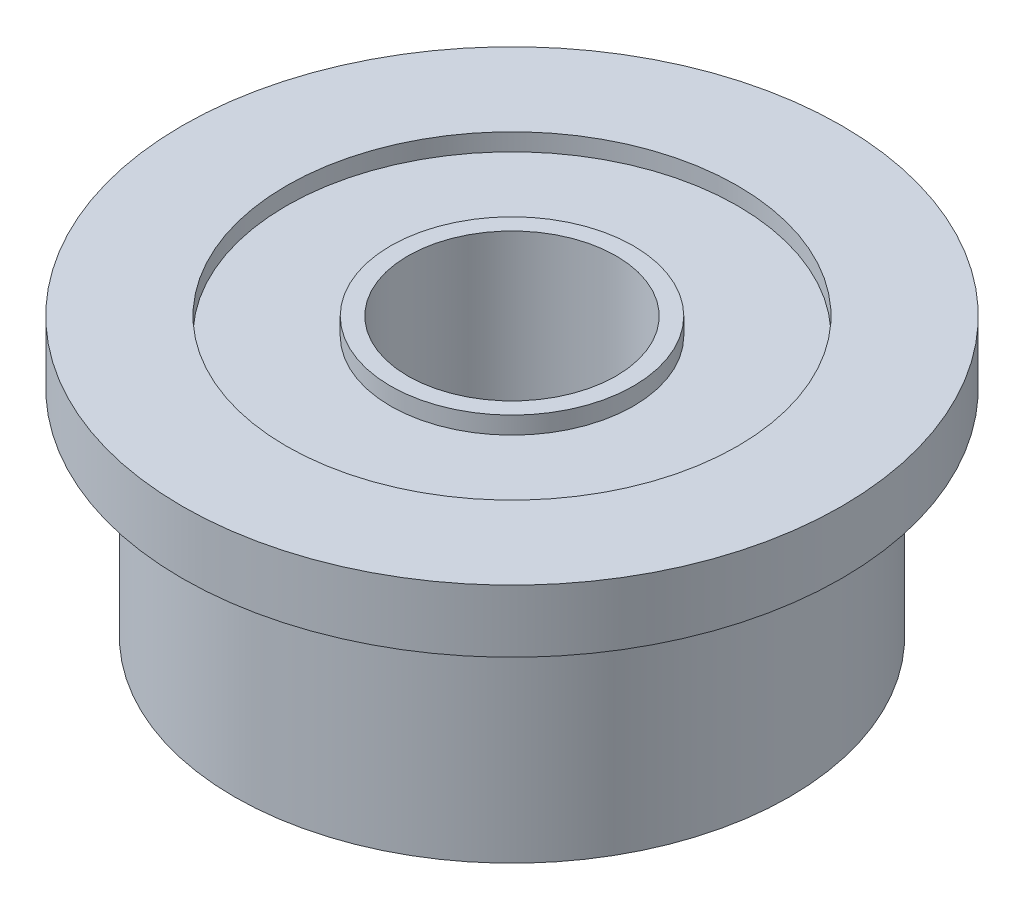
from build123d import *

# Parameters (mm, degrees)
SKETCH1_R           = 4
SKETCH1_R_2         = 1.5
BOSS_EXTRUDE1_DEPTH = 4
SKETCH2_R           = 3.25
SKETCH2_R_2         = 1.75
CUT_EXTRUDE1_DEPTH  = 0.25
BOSS_EXTRUDE2_START = -0.9
SKETCH3_R           = 4.75
SKETCH3_R_2         = 4
BOSS_EXTRUDE2_DEPTH = 0.9


with BuildPart() as part:
    # Sketch1 → Boss-Extrude1 (new body)
    with BuildSketch(Plane(origin=(0, 0, 0), x_dir=(1, 0, 0), z_dir=(0, 1, 0))):
        with Locations(Location((0, 0, 0), (0, 0, 270))):
            Circle(SKETCH1_R)
        with Locations(Location((0, 0, 0), (0, 0, 270))):
            Circle(SKETCH1_R_2, mode=Mode.SUBTRACT)
    extrude(amount=BOSS_EXTRUDE1_DEPTH)

    # Sketch2 → Cut-Extrude1 (cut)
    with BuildSketch(Plane(origin=(0, 4, 0), x_dir=(1, 0, 0), z_dir=(0, 1, 0))):
        with Locations(Location((0, 0, 0), (0, 0, 270))):
            Circle(SKETCH2_R)
        with Locations(Location((0, 0, 0), (0, 0, 270))):
            Circle(SKETCH2_R_2, mode=Mode.SUBTRACT)
    cut_extrude1 = extrude(amount=-CUT_EXTRUDE1_DEPTH, mode=Mode.SUBTRACT)

    # Mirror1: Cut-Extrude1 across plane
    add(cut_extrude1.mirror(Plane.ZX.offset(2)), mode=Mode.SUBTRACT)

    # Sketch3 → Boss-Extrude2 (add)
    with BuildSketch(Plane(origin=(0, 4, 0), x_dir=(1, 0, 0), z_dir=(0, 1, 0)).offset(BOSS_EXTRUDE2_START)):
        with Locations(Location((0, 0, 0), (0, 0, 270))):
            Circle(SKETCH3_R)
        with Locations(Location((0, 0, 0), (0, 0, 270))):
            Circle(SKETCH3_R_2, mode=Mode.SUBTRACT)
    extrude(amount=BOSS_EXTRUDE2_DEPTH)


solid = part.part
